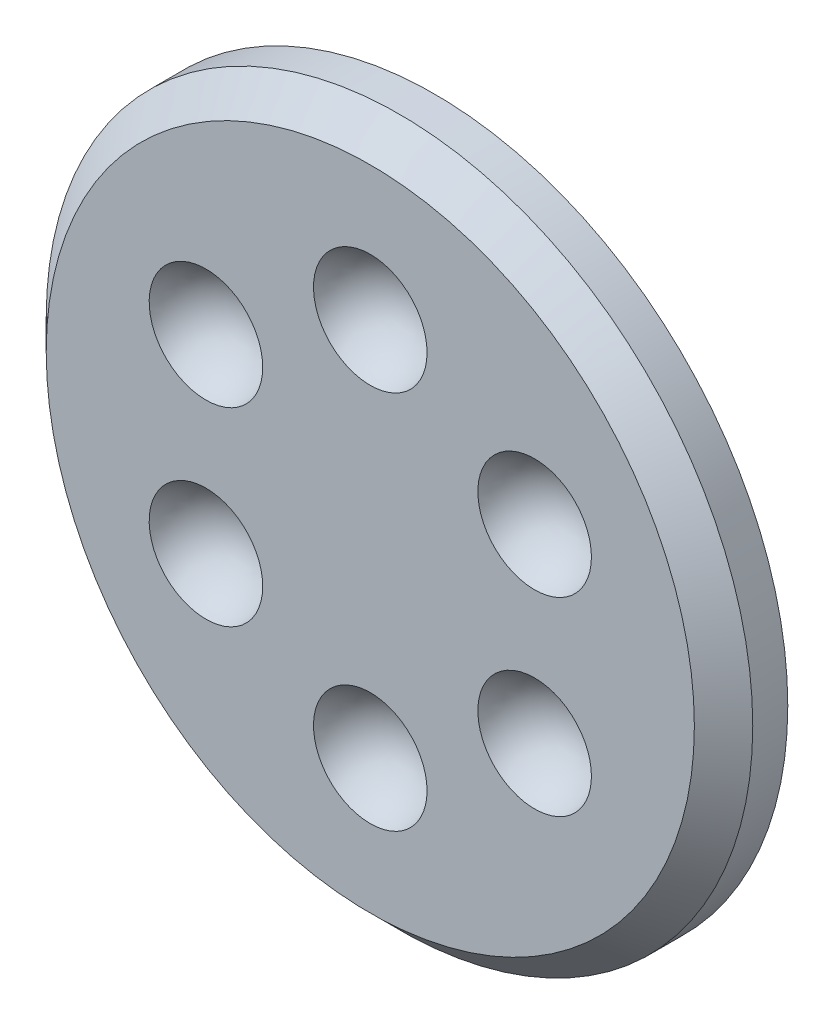
from build123d import *

# Parameters (mm, degrees)
SKETCH1_R           = 15.367
BOSS_EXTRUDE1_DEPTH = 2.794
CIRPATTERN1_COUNT   = 6
CHAMFER1_SIZE       = 1.27


with BuildPart() as part:
    # Sketch1 → Boss-Extrude1 (new body)
    with BuildSketch(Plane.XY):
        Circle(SKETCH1_R)
    extrude(amount=BOSS_EXTRUDE1_DEPTH)

    # Sketch3 → Cut-Revolve1 (revolve, cut)
    with BuildSketch(Plane(origin=(0, 0, 0), x_dir=(0, 0, -1), z_dir=(1, 0, 0))):
        with BuildLine():
            Line((-6.14045, 8.255), (-0.97155, 8.255))
            ThreePointArc((-0.97155, 8.255), (-3.556, 10.83945), (-6.14045, 8.255))
        make_face()
    cut_revolve1 = revolve(axis=Axis((0, 8.255, 6.14045), (0, 0, -1)), mode=Mode.SUBTRACT)

    # CirPattern1: Cut-Revolve1 ×6 about axis
    cirpattern1_axis = Axis((0, 0, 2.794), (0, 0, -1))
    for i in range(1, CIRPATTERN1_COUNT):
        add(cut_revolve1.rotate(cirpattern1_axis, i * 360 / CIRPATTERN1_COUNT), mode=Mode.SUBTRACT)

    # Chamfer1
    chamfer1_edges = [part.edges().sort_by_distance(p)[0] for p in [
        (-15.367, 0, 2.794),
    ]]
    chamfer(chamfer1_edges, length=CHAMFER1_SIZE)


solid = part.part
